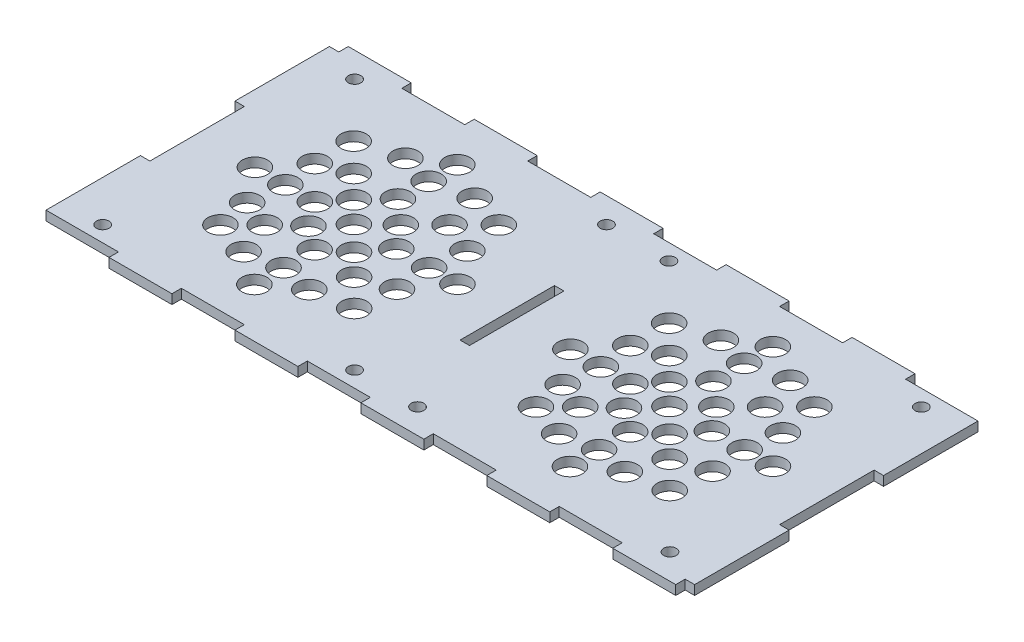
from build123d import *

# Parameters (mm, degrees)
SKETCH1_W           = 3
SKETCH1_H           = 30
BOSS_EXTRUDE1_DEPTH = 3
SKETCH2_R           = 2
SKETCH2_R_2         = 4
CUT_EXTRUDE1_DEPTH  = 3


with BuildPart() as part:
    # Sketch1 → Boss-Extrude1 (new body)
    with BuildSketch(Plane(origin=(0, 0, 0), x_dir=(1, 0, 0), z_dir=(0, 1, 0))):
        Polygon((-53.189189189, 52.918918919), (-53.189189189, 55.918918919), (-33.189189189, 55.918918919), (-33.189189189, 52.918918919), (-13.189189189, 52.918918919), (-13.189189189, 55.918918919), (6.810810811, 55.918918919), (6.810810811, 52.918918919), (26.810810811, 52.918918919), (26.810810811, 55.918918919), (46.810810811, 55.918918919), (46.810810811, 52.918918919), (66.810810811, 52.918918919), (66.810810811, 55.918918919), (86.810810811, 55.918918919), (86.810810811, 52.918918919), (106.810810811, 52.918918919), (109.810810811, 52.918918919), (109.810810811, 22.918918919), (106.810810811, 22.918918919), (106.810810811, -7.081081081), (109.810810811, -7.081081081), (109.810810811, -37.081081081), (106.810810811, -37.081081081), (106.810810811, -40.081081081), (86.810810811, -40.081081081), (86.810810811, -37.081081081), (66.810810811, -37.081081081), (66.810810811, -40.081081081), (46.810810811, -40.081081081), (46.810810811, -37.081081081), (26.810810811, -37.081081081), (26.810810811, -40.081081081), (6.810810811, -40.081081081), (6.810810811, -37.081081081), (-13.189189189, -37.081081081), (-13.189189189, -40.081081081), (-33.189189189, -40.081081081), (-33.189189189, -37.081081081), (-53.189189189, -37.081081081), (-53.189189189, -40.081081081), (-73.189189189, -40.081081081), (-73.189189189, -37.081081081), (-93.189189189, -37.081081081), (-96.189189189, -37.081081081), (-96.189189189, -7.081081081), (-93.189189189, -7.081081081), (-93.189189189, 22.918918919), (-96.189189189, 22.918918919), (-96.189189189, 52.918918919), (-93.189189189, 52.918918919), (-93.189189189, 55.918918919), (-73.189189189, 55.918918919), (-73.189189189, 52.918918919), align=None)
        with Locations((6.810810811, 7.918918919)):
            Rectangle(SKETCH1_W, SKETCH1_H, mode=Mode.SUBTRACT)
    extrude(amount=BOSS_EXTRUDE1_DEPTH)

    # Sketch2 → Cut-Extrude1 (cut)
    with BuildSketch(Plane(origin=(0, 3, 0), x_dir=(1, 0, 0), z_dir=(0, 1, 0))):
        with Locations(Location((-83.189189189, 47.918918919, 0), (0, 0, 270))):
            Circle(SKETCH2_R)
        with Locations(Location((-83.189189189, -32.081081081, 0), (0, 0, 270))):
            Circle(SKETCH2_R)
        with Locations(Location((-3.189189189, 47.918918919, 0), (0, 0, 270))):
            Circle(SKETCH2_R)
        with Locations(Location((-3.189189189, -32.081081081, 0), (0, 0, 270))):
            Circle(SKETCH2_R)
        with Locations(Location((96.97523931, 47.753811706, 0), (0, 0, 270))):
            Circle(SKETCH2_R)
        with Locations(Location((96.890661701, -31.999841307, 0), (0, 0, 270))):
            Circle(SKETCH2_R)
        with Locations(Location((16.73095992, 47.837679145, 0), (0, 0, 270))):
            Circle(SKETCH2_R)
        with Locations(Location((16.92956487, -32.199971625, 0), (0, 0, 270))):
            Circle(SKETCH2_R)
        with Locations(Location((64.409536285, 15.225493569, 0), (0, 0, 270))):
            Circle(SKETCH2_R_2)
        with Locations(Location((64.458960542, 0.301508961, 0), (0, 0, 270))):
            Circle(SKETCH2_R_2)
        with Locations(Location((72.150575188, 22.957645887, 0), (0, 0, 270))):
            Circle(SKETCH2_R_2)
        with Locations(Location((79.984903702, 30.782980722, 0), (0, 0, 270))):
            Circle(SKETCH2_R_2)
        with Locations(Location((42.782150533, -6.377064303, 0), (0, 0, 270))):
            Circle(SKETCH2_R_2)
        with Locations(Location((35.744744462, -13.406391548, 0), (0, 0, 270))):
            Circle(SKETCH2_R_2)
        with Locations(Location((50.031602385, 0.251885254, 0), (0, 0, 270))):
            Circle(SKETCH2_R_2)
        with Locations(Location((71.328743505, -6.540662674, 0), (0, 0, 270))):
            Circle(SKETCH2_R_2)
        with Locations(Location((56.810810811, 7.918918919, 0), (0, 0, 270))):
            Circle(SKETCH2_R_2)
        with Locations(Location((79.984903702, -15.162031659, 0), (0, 0, 270))):
            Circle(SKETCH2_R_2)
        with Locations(Location((50.031602385, 14.670880058, 0), (0, 0, 270))):
            Circle(SKETCH2_R_2)
        with Locations(Location((42.782150533, 21.891194601, 0), (0, 0, 270))):
            Circle(SKETCH2_R_2)
        with Locations(Location((33.854481941, 30.782980722, 0), (0, 0, 270))):
            Circle(SKETCH2_R_2)
        with Locations(Location((70.286929504, 7.918918919, 0), (0, 0, 270))):
            Circle(SKETCH2_R_2)
        with Locations(Location((80.695917052, 7.918918919, 0), (0, 0, 270))):
            Circle(SKETCH2_R_2)
        with Locations(Location((89.69828466, 7.918918919, 0), (0, 0, 270))):
            Circle(SKETCH2_R_2)
        with Locations(Location((35.027656371, 7.918918919, 0), (0, 0, 270))):
            Circle(SKETCH2_R_2)
        with Locations(Location((44.40512263, 7.918918919, 0), (0, 0, 270))):
            Circle(SKETCH2_R_2)
        with Locations(Location((25.368866125, 7.918918919, 0), (0, 0, 270))):
            Circle(SKETCH2_R_2)
        with Locations(Location((57.533575392, -5.280819839, 0), (0, 0, 270))):
            Circle(SKETCH2_R_2)
        with Locations(Location((57.533575392, -15.162031659, 0), (0, 0, 270))):
            Circle(SKETCH2_R_2)
        with Locations(Location((57.533575392, -24.410851007, 0), (0, 0, 270))):
            Circle(SKETCH2_R_2)
        with Locations(Location((56.810810811, 21.891194601, 0), (0, 0, 270))):
            Circle(SKETCH2_R_2)
        with Locations(Location((56.810810811, 31.666397221, 0), (0, 0, 270))):
            Circle(SKETCH2_R_2)
        with Locations(Location((56.810810811, 40.762539492, 0), (0, 0, 270))):
            Circle(SKETCH2_R_2)
        with Locations(Location((33.854481941, 18.444169796, 0), (0, 0, 270))):
            Circle(SKETCH2_R_2)
        with Locations(Location((46.782150533, 34.292087773, 0), (0, 0, 270))):
            Circle(SKETCH2_R_2)
        with Locations(Location((68.786534903, 34.292087773, 0), (0, 0, 270))):
            Circle(SKETCH2_R_2)
        with Locations(Location((82.102536991, 18.670880058, 0), (0, 0, 270))):
            Circle(SKETCH2_R_2)
        with Locations(Location((81.446114352, -3.030227937, 0), (0, 0, 270))):
            Circle(SKETCH2_R_2)
        with Locations(Location((67.661238952, -17.096427325, 0), (0, 0, 270))):
            Circle(SKETCH2_R_2)
        with Locations(Location((46.782150533, -17.096427325, 0), (0, 0, 270))):
            Circle(SKETCH2_R_2)
        with Locations(Location((33.854481941, -3.030227937, 0), (0, 0, 270))):
            Circle(SKETCH2_R_2)
        with Locations(Location((-35.761406417, 15.18771879, 0), (0, 0, 270))):
            Circle(SKETCH2_R_2)
        with Locations(Location((-35.71198216, 0.263734182, 0), (0, 0, 270))):
            Circle(SKETCH2_R_2)
        with Locations(Location((-28.020367515, 22.919871108, 0), (0, 0, 270))):
            Circle(SKETCH2_R_2)
        with Locations(Location((-20.186039001, 30.745205943, 0), (0, 0, 270))):
            Circle(SKETCH2_R_2)
        with Locations(Location((-57.388792169, -6.414839082, 0), (0, 0, 270))):
            Circle(SKETCH2_R_2)
        with Locations(Location((-64.42619824, -13.444166327, 0), (0, 0, 270))):
            Circle(SKETCH2_R_2)
        with Locations(Location((-50.139340317, 0.214110475, 0), (0, 0, 270))):
            Circle(SKETCH2_R_2)
        with Locations(Location((-28.842199198, -6.578437453, 0), (0, 0, 270))):
            Circle(SKETCH2_R_2)
        with Locations(Location((-43.360131891, 7.88114414, 0), (0, 0, 270))):
            Circle(SKETCH2_R_2)
        with Locations(Location((-20.186039001, -15.199806438, 0), (0, 0, 270))):
            Circle(SKETCH2_R_2)
        with Locations(Location((-50.139340317, 14.633105278, 0), (0, 0, 270))):
            Circle(SKETCH2_R_2)
        with Locations(Location((-57.388792169, 21.853419822, 0), (0, 0, 270))):
            Circle(SKETCH2_R_2)
        with Locations(Location((-66.316460761, 30.745205943, 0), (0, 0, 270))):
            Circle(SKETCH2_R_2)
        with Locations(Location((-29.884013198, 7.88114414, 0), (0, 0, 270))):
            Circle(SKETCH2_R_2)
        with Locations(Location((-19.475025651, 7.88114414, 0), (0, 0, 270))):
            Circle(SKETCH2_R_2)
        with Locations(Location((-10.472658042, 7.88114414, 0), (0, 0, 270))):
            Circle(SKETCH2_R_2)
        with Locations(Location((-65.143286331, 7.88114414, 0), (0, 0, 270))):
            Circle(SKETCH2_R_2)
        with Locations(Location((-55.765820072, 7.88114414, 0), (0, 0, 270))):
            Circle(SKETCH2_R_2)
        with Locations(Location((-74.802076578, 7.88114414, 0), (0, 0, 270))):
            Circle(SKETCH2_R_2)
        with Locations(Location((-42.63736731, -5.318594618, 0), (0, 0, 270))):
            Circle(SKETCH2_R_2)
        with Locations(Location((-42.63736731, -15.199806438, 0), (0, 0, 270))):
            Circle(SKETCH2_R_2)
        with Locations(Location((-42.63736731, -24.448625786, 0), (0, 0, 270))):
            Circle(SKETCH2_R_2)
        with Locations(Location((-43.360131891, 21.853419822, 0), (0, 0, 270))):
            Circle(SKETCH2_R_2)
        with Locations(Location((-43.360131891, 31.628622442, 0), (0, 0, 270))):
            Circle(SKETCH2_R_2)
        with Locations(Location((-43.360131891, 40.724764713, 0), (0, 0, 270))):
            Circle(SKETCH2_R_2)
        with Locations(Location((-66.316460761, 18.406395017, 0), (0, 0, 270))):
            Circle(SKETCH2_R_2)
        with Locations(Location((-53.388792169, 34.254312994, 0), (0, 0, 270))):
            Circle(SKETCH2_R_2)
        with Locations(Location((-31.384407799, 34.254312994, 0), (0, 0, 270))):
            Circle(SKETCH2_R_2)
        with Locations(Location((-18.068405712, 18.633105278, 0), (0, 0, 270))):
            Circle(SKETCH2_R_2)
        with Locations(Location((-18.72482835, -3.068002716, 0), (0, 0, 270))):
            Circle(SKETCH2_R_2)
        with Locations(Location((-32.50970375, -17.134202104, 0), (0, 0, 270))):
            Circle(SKETCH2_R_2)
        with Locations(Location((-53.388792169, -17.134202104, 0), (0, 0, 270))):
            Circle(SKETCH2_R_2)
        with Locations(Location((-66.316460761, -3.068002716, 0), (0, 0, 270))):
            Circle(SKETCH2_R_2)
    extrude(amount=-CUT_EXTRUDE1_DEPTH, mode=Mode.SUBTRACT)


solid = part.part
